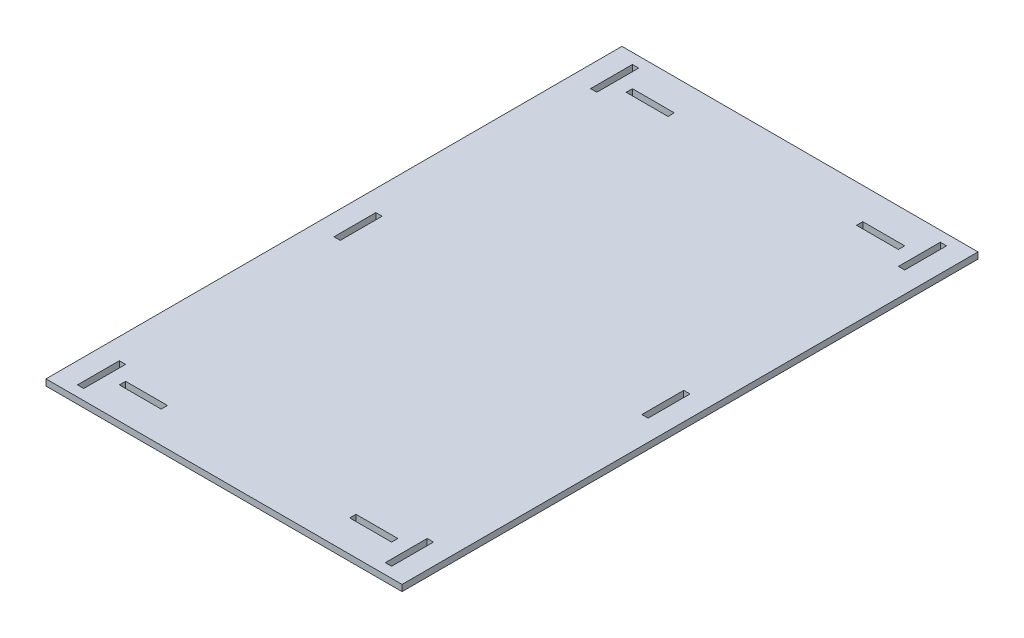
from build123d import *

# Parameters (mm, degrees)
SKETCH1_W            = 340
SKETCH1_H            = 550
BOSS_EXTRUDE1_DEPTH  = 6
SKETCH2_W            = 6
SKETCH2_H            = 40
CUT_EXTRUDE1_DEPTH   = 6
LPATTERN1_COUNT      = 2
LPATTERN1_PITCH      = 294
LPATTERN1_COUNT_DIR2 = 3
LPATTERN1_PITCH_DIR2 = 245
SKETCH3_W            = 40
SKETCH3_H            = 6
CUT_EXTRUDE2_DEPTH   = 10
LPATTERN2_COUNT      = 2
LPATTERN2_PITCH      = 220
LPATTERN2_COUNT_DIR2 = 2
LPATTERN2_PITCH_DIR2 = 484


with BuildPart() as part:
    # Sketch1 → Boss-Extrude1 (new body)
    with BuildSketch(Plane(origin=(0, 0, 0), x_dir=(1, 0, 0), z_dir=(0, 1, 0))):
        with Locations((170, 275)):
            Rectangle(SKETCH1_W, SKETCH1_H)
    extrude(amount=BOSS_EXTRUDE1_DEPTH)

    # Sketch2 → Cut-Extrude1 (cut)
    with BuildSketch(Plane(origin=(0, 6, 0), x_dir=(1, 0, 0), z_dir=(0, 1, 0))):
        with Locations((23, 520)):
            Rectangle(SKETCH2_W, SKETCH2_H)
    cut_extrude1 = extrude(amount=-CUT_EXTRUDE1_DEPTH, mode=Mode.SUBTRACT)

    # LPattern1: Cut-Extrude1 2 × 3
    with Locations(*[(i * LPATTERN1_PITCH, 0, j * LPATTERN1_PITCH_DIR2) for i in range(LPATTERN1_COUNT) for j in range(LPATTERN1_COUNT_DIR2) if (i, j) != (0, 0)]):
        add(cut_extrude1, mode=Mode.SUBTRACT)

    # Sketch3 → Cut-Extrude2 (cut)
    with BuildSketch(Plane(origin=(0, 6, 0), x_dir=(1, 0, 0), z_dir=(0, 1, 0))):
        with Locations((280, 517)):
            Rectangle(SKETCH3_W, SKETCH3_H)
    cut_extrude2 = extrude(amount=-CUT_EXTRUDE2_DEPTH, mode=Mode.SUBTRACT)

    # LPattern2: Cut-Extrude2 2 × 2
    with Locations(*[(-i * LPATTERN2_PITCH, 0, j * LPATTERN2_PITCH_DIR2) for i in range(LPATTERN2_COUNT) for j in range(LPATTERN2_COUNT_DIR2) if (i, j) != (0, 0)]):
        add(cut_extrude2, mode=Mode.SUBTRACT)


solid = part.part
